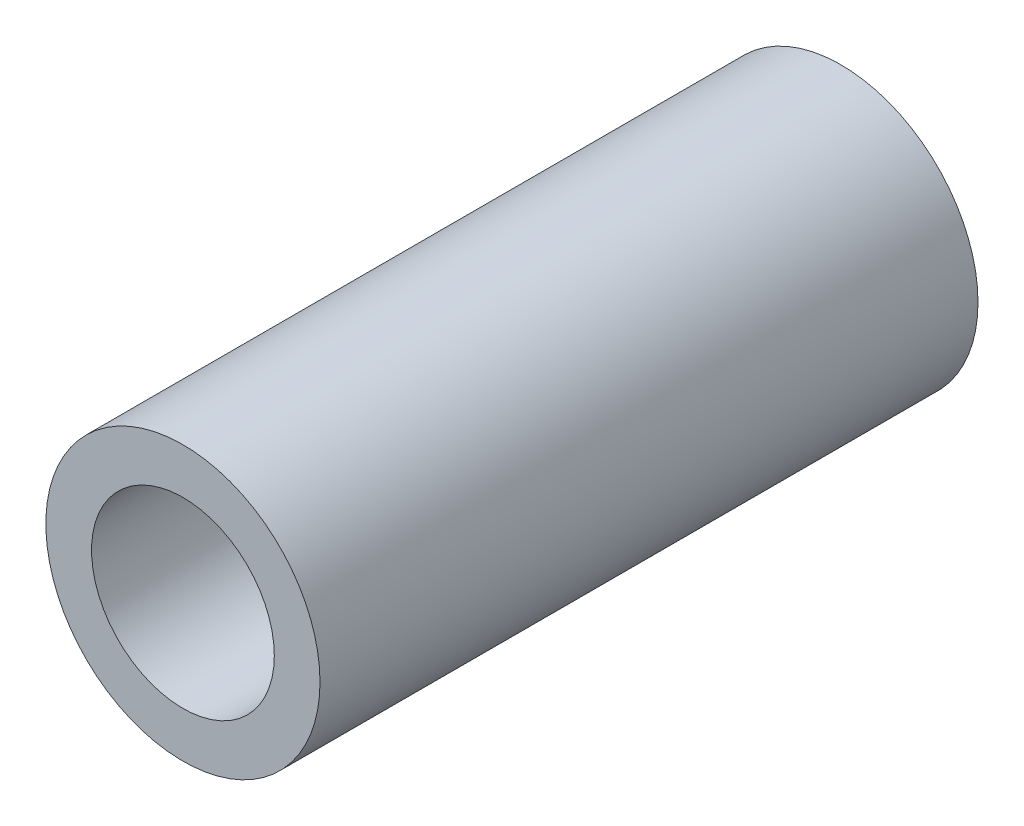
from build123d import *

# Parameters (mm, degrees)
SKETCH_1_R      = 1.5
SKETCH_1_R_2    = 1
EXTRUDE_5_DEPTH = 7.2


with BuildPart() as part:
    # Эскиз1 → Бобышка-Вытянуть5 (new body)
    with BuildSketch(Plane.XY):
        Circle(SKETCH_1_R)
        Circle(SKETCH_1_R_2, mode=Mode.SUBTRACT)
    extrude(amount=EXTRUDE_5_DEPTH)


solid = part.part
